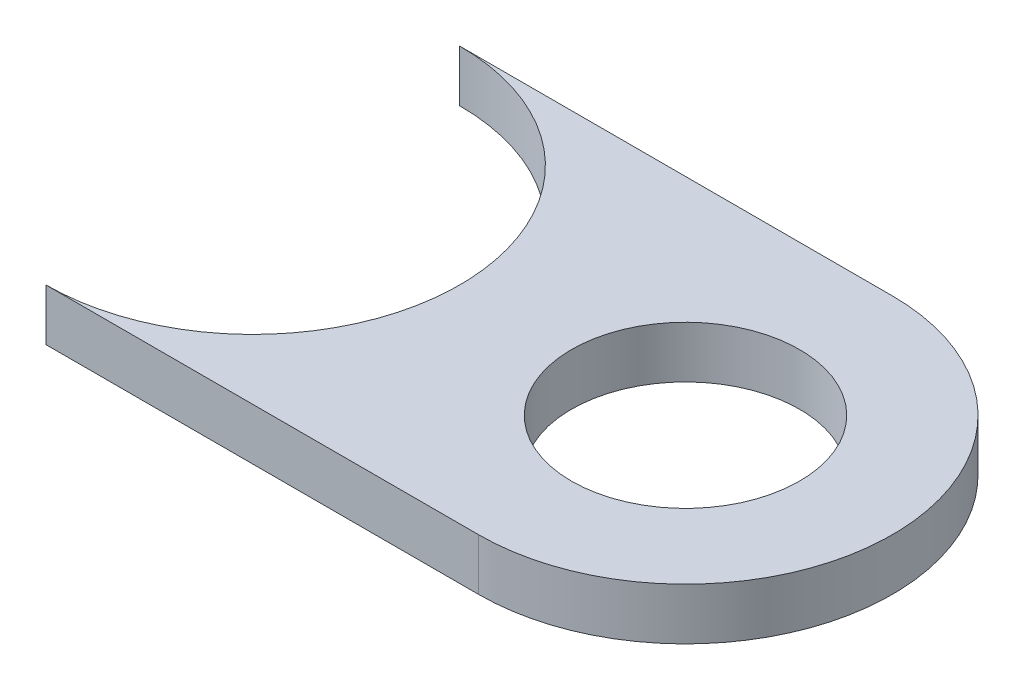
from build123d import *

# Parameters (mm, degrees)
SKETCH1_R           = 7.00024
BOSS_EXTRUDE1_DEPTH = 3.175


with BuildPart() as part:
    # Sketch1 → Boss-Extrude1 (new body)
    with BuildSketch(Plane(origin=(0, 0, 0), x_dir=(1, 0, 0), z_dir=(0, 1, 0))):
        with BuildLine():
            Line((-26.56078, 12.7), (0, 12.7))
            ThreePointArc((0, 12.7), (12.7, 0), (0, -12.7))
            Line((0, -12.7), (-26.56078, -12.7))
            ThreePointArc((-26.56078, -12.7), (-13.86078, 0), (-26.56078, 12.7))
        make_face()
        with Locations(Location((0, 0, 0), (0, 0, 270))):
            Circle(SKETCH1_R, mode=Mode.SUBTRACT)
    extrude(amount=BOSS_EXTRUDE1_DEPTH)


solid = part.part
